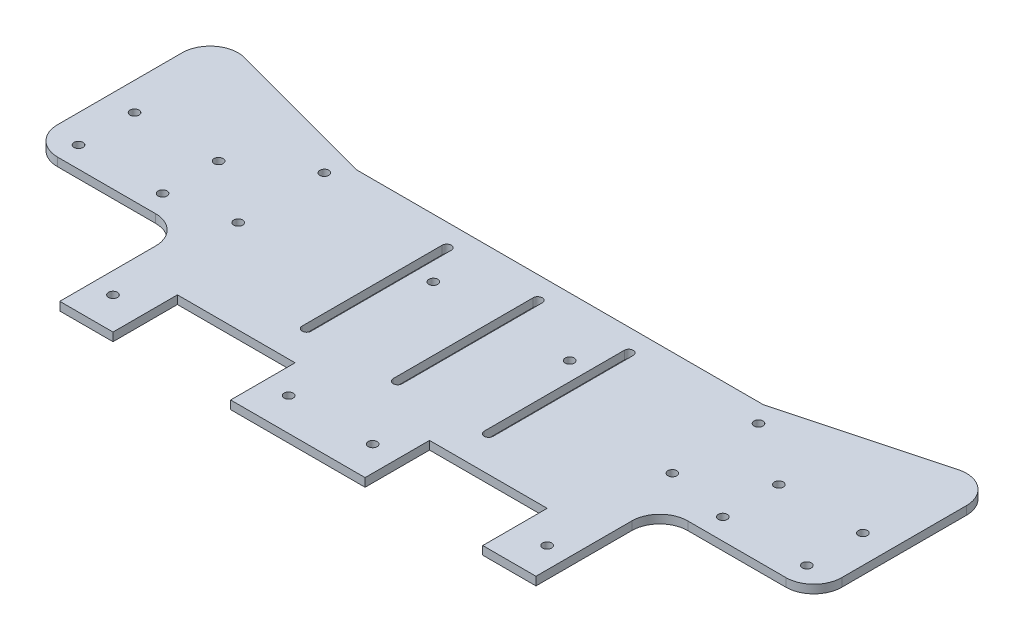
from build123d import *

# Parameters (mm, degrees)
BOSS_EXTRUDE1_DEPTH = 3
FILLET1_R           = 200
FILLET2_R           = 10
CUT_EXTRUDE2_DEPTH  = 429.345808882
SKETCH3_W           = 42
SKETCH3_H           = 23
SKETCH3_H_2         = 19
CUT_EXTRUDE3_DEPTH  = 429.345808882
SKETCH4_R           = 1.6
CUT_EXTRUDE5_DEPTH  = 429.345808882
SKETCH5_R           = 1.6
CUT_EXTRUDE6_DEPTH  = 429.345808882
SKETCH6_W           = 66
SKETCH6_H           = 15
SKETCH6_R           = 1.6
BOSS_EXTRUDE2_DEPTH = 3
FILLET3_R           = 5
SKETCH7_R           = 1.6
CUT_EXTRUDE7_DEPTH  = 435.224748243
SKETCH9_R           = 1.6
CUT_EXTRUDE8_DEPTH  = 435.224748243
SKETCH10_W          = 302
SKETCH10_H          = 255.8
CUT_EXTRUDE9_DEPTH  = 10
BOSS_EXTRUDE5_DEPTH = 3
CUT_EXTRUDE10_DEPTH = 10


with BuildPart() as part:
    # Sketch1 → Boss-Extrude1 (new body)
    with BuildSketch(Plane(origin=(0, 0, 0), x_dir=(1, 0, 0), z_dir=(0, 1, 0))):
        Polygon((0, 0), (170, 0), (170, 300), (225, 300), (225, 367.51288694), (85, 330), (-55, 367.51288694), (-55, 300), (0, 300), align=None)
    extrude(amount=BOSS_EXTRUDE1_DEPTH)

    # Fillet1
    fillet1_edges = [part.edges().sort_by_distance(p)[0] for p in [
        (85, 1.5, -330),
    ]]
    fillet(fillet1_edges, radius=FILLET1_R)

    # Fillet2
    fillet2_edges = [part.edges().sort_by_distance(p)[0] for p in [
        (0, 1.5, -300),
        (-55, 1.5, -300),
        (-55, 1.5, -367.51288694),
        (225, 1.5, -367.51288694),
        (225, 1.5, -300),
        (170, 1.5, -300),
        (170, 1.5, 0),
        (0, 1.5, 0),
    ]]
    fillet(fillet2_edges, radius=FILLET2_R)

    # Sketch2 → Cut-Extrude2 (cut, through all)
    with BuildSketch(Plane(origin=(0, 3, 0), x_dir=(1, 0, 0), z_dir=(0, 1, 0))):
        with BuildLine():
            ThreePointArc((132.5, 80), (118.587572106, 113.587572106), (85, 127.5))
            Line((85, 127.5), (85, 32.5))
            ThreePointArc((85, 32.5), (118.587572106, 46.412427894), (132.5, 80))
        make_face()
        with BuildLine():
            Line((85, 32.5), (85, 127.5))
            ThreePointArc((85, 127.5), (37.5, 80), (85, 32.5))
        make_face()
    extrude(amount=-CUT_EXTRUDE2_DEPTH, mode=Mode.SUBTRACT)

    # Sketch3 → Cut-Extrude3 (cut, through all)
    with BuildSketch(Plane(origin=(0, 3, 0), x_dir=(1, 0, 0), z_dir=(0, 1, 0))):
        with Locations((40, 267.3)):
            Rectangle(SKETCH3_W, SKETCH3_H)
        with Locations((130, 267.3)):
            Rectangle(SKETCH3_W, SKETCH3_H)
        with Locations((40, 9.5)):
            Rectangle(SKETCH3_W, SKETCH3_H_2)
        with Locations((130, 9.5)):
            Rectangle(SKETCH3_W, SKETCH3_H_2)
    extrude(amount=-CUT_EXTRUDE3_DEPTH, mode=Mode.SUBTRACT)

    # Sketch4 → Cut-Extrude5 (cut, through all)
    with BuildSketch(Plane(origin=(0, 3, 0), x_dir=(1, 0, 0), z_dir=(0, 1, 0))):
        with Locations(Location((85, 133, 0), (0, 0, 270))):
            Circle(SKETCH4_R)
        with Locations(Location((122.476659403, 117.476659403, 0), (0, 0, 270))):
            Circle(SKETCH4_R)
        with Locations(Location((138, 80, 0), (0, 0, 270))):
            Circle(SKETCH4_R)
        with Locations(Location((122.476659403, 42.523340597, 0), (0, 0, 270))):
            Circle(SKETCH4_R)
        with Locations(Location((85, 27, 0), (0, 0, 270))):
            Circle(SKETCH4_R)
        with Locations(Location((47.523340597, 42.523340597, 0), (0, 0, 270))):
            Circle(SKETCH4_R)
        with Locations(Location((32, 80, 0), (0, 0, 270))):
            Circle(SKETCH4_R)
        with Locations(Location((47.523340597, 117.476659403, 0), (0, 0, 270))):
            Circle(SKETCH4_R)
    extrude(amount=-CUT_EXTRUDE5_DEPTH, mode=Mode.SUBTRACT)

    # Sketch5 → Cut-Extrude6 (cut, through all)
    with BuildSketch(Plane(origin=(0, 3, 0), x_dir=(1, 0, 0), z_dir=(0, 1, 0))):
        with Locations(Location((7.5, 312, 0), (0, 0, 270))):
            Circle(SKETCH5_R)
        with Locations(Location((7.5, 267.3, 0), (0, 0, 270))):
            Circle(SKETCH5_R)
        with Locations(Location((7.5, 222.3, 0), (0, 0, 270))):
            Circle(SKETCH5_R)
        with Locations(Location((7.5, 97.5, 0), (0, 0, 270))):
            Circle(SKETCH5_R)
        with Locations(Location((7.5, 7.5, 0), (0, 0, 270))):
            Circle(SKETCH5_R)
        with Locations(Location((7.5, 52.5, 0), (0, 0, 270))):
            Circle(SKETCH5_R)
        with Locations(Location((70, 7.5, 0), (0, 0, 270))):
            Circle(SKETCH5_R)
        with Locations(Location((100, 7.5, 0), (0, 0, 270))):
            Circle(SKETCH5_R)
        with Locations(Location((162.5, 7.5, 0), (0, 0, 270))):
            Circle(SKETCH5_R)
        with Locations(Location((162.5, 52.5, 0), (0, 0, 270))):
            Circle(SKETCH5_R)
        with Locations(Location((162.5, 97.5, 0), (0, 0, 270))):
            Circle(SKETCH5_R)
        with Locations(Location((162.5, 222.3, 0), (0, 0, 270))):
            Circle(SKETCH5_R)
        with Locations(Location((162.5, 267.3, 0), (0, 0, 270))):
            Circle(SKETCH5_R)
        with Locations(Location((162.5, 312, 0), (0, 0, 270))):
            Circle(SKETCH5_R)
        with Locations(Location((162.5, 342.75495241, 0), (0, 0, 270))):
            Circle(SKETCH5_R)
        with Locations(Location((109.337835254, 328.510193298, 0), (0, 0, 270))):
            Circle(SKETCH5_R)
        with Locations(Location((60.662164746, 328.510193298, 0), (0, 0, 270))):
            Circle(SKETCH5_R)
        with Locations(Location((7.5, 342.75495241, 0), (0, 0, 270))):
            Circle(SKETCH5_R)
        with Locations(Location((70, 267.5, 0), (0, 0, 270))):
            Circle(SKETCH5_R)
        with Locations(Location((100, 267.5, 0), (0, 0, 270))):
            Circle(SKETCH5_R)
    extrude(amount=-CUT_EXTRUDE6_DEPTH, mode=Mode.SUBTRACT)

    # Sketch6 → Boss-Extrude2 (add)
    # profile 1 of 2: a face of its own
    with BuildSketch(Plane.XZ):
        with Locations((-33, -52.5)):
            Rectangle(SKETCH6_W, SKETCH6_H)
        with Locations(Location((-45, -52.5, 0), (0, 0, 270))):
            Circle(SKETCH6_R, mode=Mode.SUBTRACT)
        with Locations(Location((-21, -52.5, 0), (0, 0, 270))):
            Circle(SKETCH6_R, mode=Mode.SUBTRACT)
    # profile 2 of 2: a face of its own
    with BuildSketch(Plane.XZ):
        with Locations((203, -52.5)):
            Rectangle(SKETCH6_W, SKETCH6_H)
        with Locations(Location((191, -52.5, 0), (0, 0, 270))):
            Circle(SKETCH6_R, mode=Mode.SUBTRACT)
        with Locations(Location((215, -52.5, 0), (0, 0, 270))):
            Circle(SKETCH6_R, mode=Mode.SUBTRACT)
    extrude(amount=-BOSS_EXTRUDE2_DEPTH)

    # Fillet3
    fillet3_edges = [part.edges().sort_by_distance(p)[0] for p in [
        (19, 1.5, 0),
        (61, 1.5, 0),
        (109, 1.5, 0),
        (109, 1.5, -19),
        (151, 1.5, -19),
        (151, 1.5, 0),
        (0, 1.5, -45),
        (0, 1.5, -60),
        (-66, 1.5, -60),
        (-66, 1.5, -45),
        (170, 1.5, -60),
        (170, 1.5, -45),
        (236, 1.5, -45),
        (236, 1.5, -60),
    ]]
    fillet(fillet3_edges, radius=FILLET3_R)

    # Sketch7 → Cut-Extrude7 (cut, through all)
    with BuildSketch(Plane(origin=(0, 3, 0), x_dir=(1, 0, 0), z_dir=(0, 1, 0))):
        with Locations(Location((130, 171.5, 0), (0, 0, 270))):
            Circle(SKETCH7_R)
        with Locations(Location((145, 171.5, 0), (0, 0, 270))):
            Circle(SKETCH7_R)
        with Locations(Location((145, 159.5, 0), (0, 0, 270))):
            Circle(SKETCH7_R)
        with Locations(Location((130, 159.5, 0), (0, 0, 270))):
            Circle(SKETCH7_R)
        with Locations(Location((25, 171.5, 0), (0, 0, 270))):
            Circle(SKETCH7_R)
        with Locations(Location((40, 171.5, 0), (0, 0, 270))):
            Circle(SKETCH7_R)
        with Locations(Location((40, 159.5, 0), (0, 0, 270))):
            Circle(SKETCH7_R)
        with Locations(Location((25, 159.5, 0), (0, 0, 270))):
            Circle(SKETCH7_R)
        with Locations(Location((70, 242, 0), (0, 0, 270))):
            Circle(SKETCH7_R)
        with Locations(Location((100, 242, 0), (0, 0, 270))):
            Circle(SKETCH7_R)
    extrude(amount=-CUT_EXTRUDE7_DEPTH, mode=Mode.SUBTRACT)

    # Sketch9 → Cut-Extrude8 (cut, through all)
    with BuildSketch(Plane(origin=(0, 3, 0), x_dir=(1, 0, 0), z_dir=(0, 1, 0))):
        with Locations(Location((-45, 307.5, 0), (0, 0, 270))):
            Circle(SKETCH9_R)
        with Locations(Location((-15, 307.5, 0), (0, 0, 270))):
            Circle(SKETCH9_R)
        with Locations(Location((-45, 327.5, 0), (0, 0, 270))):
            Circle(SKETCH9_R)
        with Locations(Location((-15, 327.5, 0), (0, 0, 270))):
            Circle(SKETCH9_R)
        with Locations(Location((185, 307.5, 0), (0, 0, 90))):
            Circle(SKETCH9_R)
        with Locations(Location((185, 327.5, 0), (0, 0, 90))):
            Circle(SKETCH9_R)
        with Locations(Location((215, 307.5, 0), (0, 0, 90))):
            Circle(SKETCH9_R)
        with Locations(Location((215, 327.5, 0), (0, 0, 90))):
            Circle(SKETCH9_R)
    extrude(amount=-CUT_EXTRUDE8_DEPTH, mode=Mode.SUBTRACT)

    # Sketch10 → Cut-Extrude9 (cut)
    with BuildSketch(Plane(origin=(0, 3, 0), x_dir=(1, 0, 0), z_dir=(0, 1, 0))):
        with Locations((85, 127.9)):
            Rectangle(SKETCH10_W, SKETCH10_H)
    extrude(amount=-CUT_EXTRUDE9_DEPTH, mode=Mode.SUBTRACT)

    # Sketch11 → Boss-Extrude5 (add)
    with BuildSketch(Plane(origin=(0, 3, 0), x_dir=(1, 0, 0), z_dir=(0, 1, 0))):
        with BuildLine():
            Line((33.236190979, 343.870070824), (12.5, 349.426316451))
            Line((12.5, 349.426316451), (157.5, 349.426316451))
            Line((157.5, 349.426316451), (136.763809021, 343.870070824))
            ThreePointArc((136.763809021, 343.870070824), (85, 337.055236082), (33.236190979, 343.870070824))
        make_face()
    extrude(amount=-BOSS_EXTRUDE5_DEPTH)

    # Sketch12 → Cut-Extrude10 (cut)
    with BuildSketch(Plane(origin=(0, 3, 0), x_dir=(1, 0, 0), z_dir=(0, 1, 0))):
        with BuildLine():
            Line((50.9, 341.426316451), (50.9, 291.426316451))
            ThreePointArc((50.9, 291.426316451), (52.5, 289.826316451), (54.1, 291.426316451))
            Line((54.1, 291.426316451), (54.1, 341.426316451))
            ThreePointArc((54.1, 341.426316451), (52.5, 343.026316451), (50.9, 341.426316451))
        make_face()
        with BuildLine():
            Line((83.4, 341.426316451), (83.4, 291.426316451))
            ThreePointArc((83.4, 291.426316451), (85, 289.826316451), (86.6, 291.426316451))
            Line((86.6, 291.426316451), (86.6, 341.426316451))
            ThreePointArc((86.6, 341.426316451), (85, 343.026316451), (83.4, 341.426316451))
        make_face()
        with BuildLine():
            Line((115.9, 341.426316451), (115.9, 291.426316451))
            ThreePointArc((115.9, 291.426316451), (117.5, 289.826316451), (119.1, 291.426316451))
            Line((119.1, 291.426316451), (119.1, 341.426316451))
            ThreePointArc((119.1, 341.426316451), (117.5, 343.026316451), (115.9, 341.426316451))
        make_face()
    extrude(amount=-CUT_EXTRUDE10_DEPTH, mode=Mode.SUBTRACT)


solid = part.part
